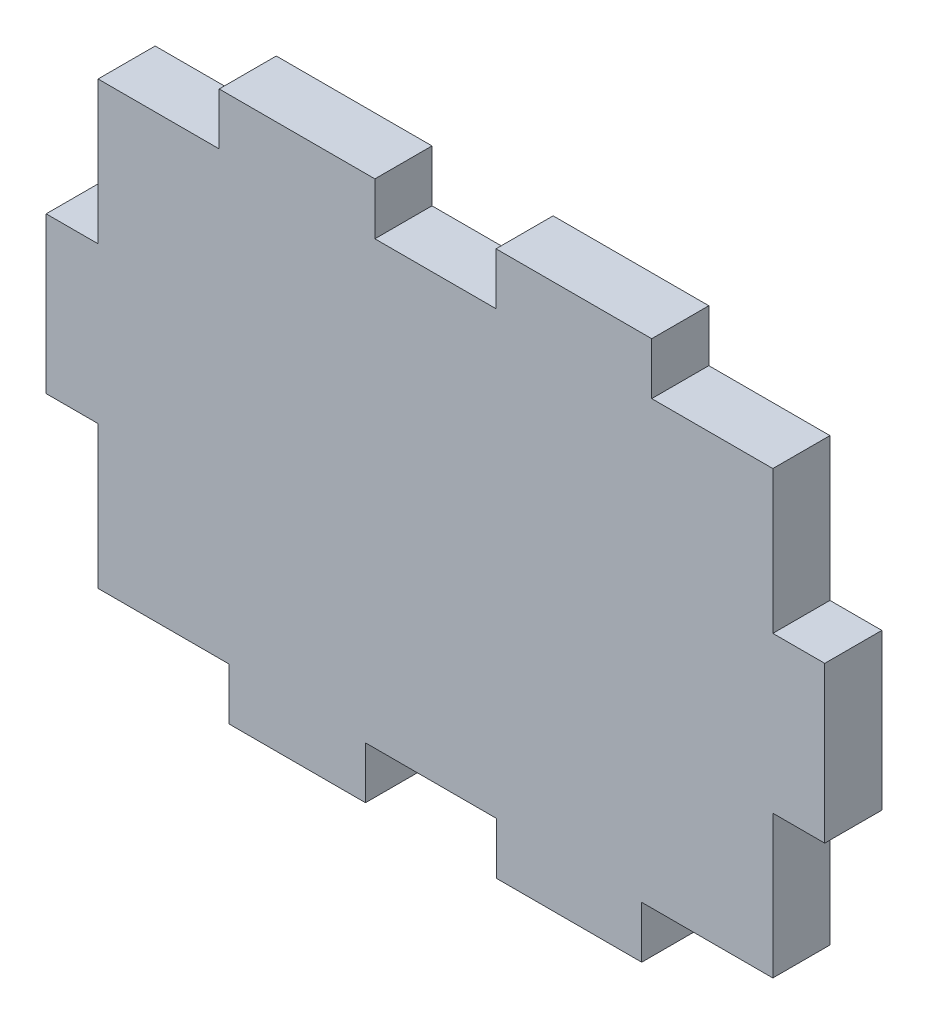
from build123d import *

# Parameters (mm, degrees)
BOSS_EXTRUDE3_DEPTH = 5.588


with BuildPart() as part:
    # Sketch1 → Boss-Extrude3 (new body)
    with BuildSketch(Plane.XY):
        Polygon((-5.926666667, 21.59), (5.926666667, 21.59), (5.926666667, 26.67), (21.166666667, 26.67), (21.166666667, 21.59), (33.02, 21.59), (33.02, 7.62), (38.1, 7.62), (38.1, -7.62), (33.02, -7.62), (33.02, -21.59), (20.188138196, -21.59), (20.188138196, -26.67), (5.985237219, -26.67), (5.985237219, -21.59), (-6.846624585, -21.59), (-6.846624585, -26.67), (-20.188138196, -26.67), (-20.188138196, -21.59), (-33.02, -21.59), (-33.02, -7.62), (-38.1, -7.62), (-38.1, 7.62), (-33.02, 7.62), (-33.02, 21.59), (-21.166666667, 21.59), (-21.166666667, 26.67), (-5.926666667, 26.67), align=None)
    extrude(amount=BOSS_EXTRUDE3_DEPTH)


solid = part.part
